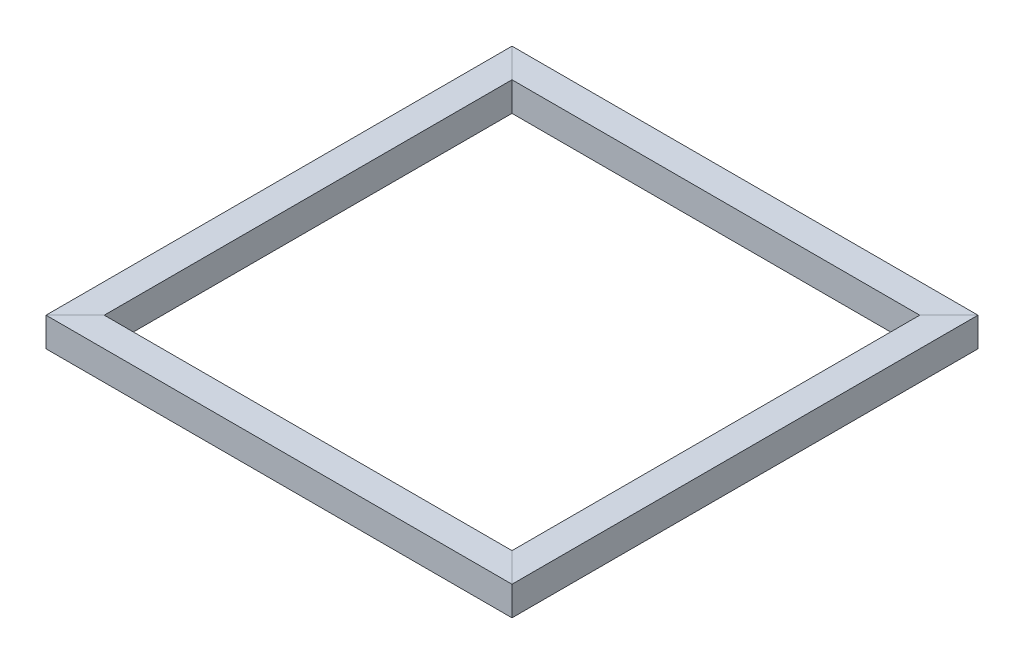
from build123d import *

# Parameters (mm, degrees)
TUBO_CUADRADO_20_X_20_X_2_2_DEPTH      = 315.142135624
TUBO_CUADRADO_20_X_20_X_2_2_DEPTH_BACK = 15.142135624
SKETCH1_W                              = 20
SKETCH1_H                              = 20
SKETCH1_W_2                            = 16
SKETCH1_H_2                            = 16
SKETCH1_ON_SEGMENT_2_W                 = 20
SKETCH1_ON_SEGMENT_2_H                 = 20
SKETCH1_ON_SEGMENT_2_W_2               = 16
SKETCH1_ON_SEGMENT_2_H_2               = 16
TUBO_CUADRADO_20_X_20_X_2_2_2_DEPTH    = 330.284271247
SKETCH1_ON_SEGMENT_3_W                 = 20
SKETCH1_ON_SEGMENT_3_H                 = 20
SKETCH1_ON_SEGMENT_3_W_2               = 16
SKETCH1_ON_SEGMENT_3_H_2               = 16
TUBO_CUADRADO_20_X_20_X_2_2_3_DEPTH    = 330.284271247
SKETCH1_ON_SEGMENT_4_W                 = 20
SKETCH1_ON_SEGMENT_4_H                 = 20
SKETCH1_ON_SEGMENT_4_W_2               = 16
SKETCH1_ON_SEGMENT_4_H_2               = 16
TUBO_CUADRADO_20_X_20_X_2_2_4_DEPTH    = 330.284271247


with BuildPart() as part:
    # Sketch1 → Tubo cuadrado 20 X 20 X 2(2) (new, two sides: drawn at the far end of the back side and taken through both)
    with BuildSketch(Plane(origin=(-150, 0, -150), x_dir=(1, 0, 0), z_dir=(0, 0, 1)).offset(-TUBO_CUADRADO_20_X_20_X_2_2_DEPTH_BACK)):
        Rectangle(SKETCH1_W, SKETCH1_H)
        Rectangle(SKETCH1_W_2, SKETCH1_H_2, mode=Mode.SUBTRACT)
    extrude(amount=TUBO_CUADRADO_20_X_20_X_2_2_DEPTH + TUBO_CUADRADO_20_X_20_X_2_2_DEPTH_BACK)

    # Tubo cuadrado 20 X 20 X 2(2) mitre 1
    split(bisect_by=Plane(origin=(-150, 0, -150), x_dir=(0, -1, 0), z_dir=(-0.707106781, 0, 0.707106781)), keep=Keep.TOP)

    # Tubo cuadrado 20 X 20 X 2(2) mitre 2
    split(bisect_by=Plane(origin=(-150, 0, 150), x_dir=(0, -1, 0), z_dir=(-0.707106781, 0, -0.707106781)), keep=Keep.TOP)


with BuildPart() as body_2:
    # Sketch1 on segment 2 (carried to segment 2) → Tubo cuadrado 20 X 20 X 2_2 2 (new body)
    with BuildSketch(Plane(origin=(-165.142135624, 0, 150), x_dir=(0, 0, -1), z_dir=(1, 0, 0))):
        Rectangle(SKETCH1_ON_SEGMENT_2_W, SKETCH1_ON_SEGMENT_2_H)
        Rectangle(SKETCH1_ON_SEGMENT_2_W_2, SKETCH1_ON_SEGMENT_2_H_2, mode=Mode.SUBTRACT)
    extrude(amount=TUBO_CUADRADO_20_X_20_X_2_2_2_DEPTH)

    # Tubo cuadrado 20 X 20 X 2_2 2 mitre 1
    split(bisect_by=Plane(origin=(-150, 0, 150), x_dir=(0, 1, 0), z_dir=(0.707106781, 0, 0.707106781)), keep=Keep.TOP)

    # Tubo cuadrado 20 X 20 X 2_2 2 mitre 2
    split(bisect_by=Plane(origin=(150, 0, 150), x_dir=(0, -1, 0), z_dir=(-0.707106781, 0, 0.707106781)), keep=Keep.TOP)


with BuildPart() as body_3:
    # Sketch1 on segment 3 (carried to segment 3) → Tubo cuadrado 20 X 20 X 2_2 3 (new body)
    with BuildSketch(Plane(origin=(150, 0, 165.142135624), x_dir=(-1, 0, 0), z_dir=(0, 0, -1))):
        Rectangle(SKETCH1_ON_SEGMENT_3_W, SKETCH1_ON_SEGMENT_3_H)
        Rectangle(SKETCH1_ON_SEGMENT_3_W_2, SKETCH1_ON_SEGMENT_3_H_2, mode=Mode.SUBTRACT)
    extrude(amount=TUBO_CUADRADO_20_X_20_X_2_2_3_DEPTH)

    # Tubo cuadrado 20 X 20 X 2_2 3 mitre 1
    split(bisect_by=Plane(origin=(150, 0, -150), x_dir=(0, 1, 0), z_dir=(0.707106781, 0, 0.707106781)), keep=Keep.TOP)

    # Tubo cuadrado 20 X 20 X 2_2 3 mitre 2
    split(bisect_by=Plane(origin=(150, 0, 150), x_dir=(0, 1, 0), z_dir=(0.707106781, 0, -0.707106781)), keep=Keep.TOP)


with BuildPart() as body_4:
    # Sketch1 on segment 4 (carried to segment 4) → Tubo cuadrado 20 X 20 X 2_2 4 (new body)
    with BuildSketch(Plane(origin=(165.142135624, 0, -150), x_dir=(0, 0, 1), z_dir=(-1, 0, 0))):
        Rectangle(SKETCH1_ON_SEGMENT_4_W, SKETCH1_ON_SEGMENT_4_H)
        Rectangle(SKETCH1_ON_SEGMENT_4_W_2, SKETCH1_ON_SEGMENT_4_H_2, mode=Mode.SUBTRACT)
    extrude(amount=TUBO_CUADRADO_20_X_20_X_2_2_4_DEPTH)

    # Tubo cuadrado 20 X 20 X 2_2 4 mitre 1
    split(bisect_by=Plane(origin=(-150, 0, -150), x_dir=(0, 1, 0), z_dir=(0.707106781, 0, -0.707106781)), keep=Keep.TOP)

    # Tubo cuadrado 20 X 20 X 2_2 4 mitre 2
    split(bisect_by=Plane(origin=(150, 0, -150), x_dir=(0, -1, 0), z_dir=(-0.707106781, 0, -0.707106781)), keep=Keep.TOP)


solid = Compound([part.part, body_2.part, body_3.part, body_4.part])
